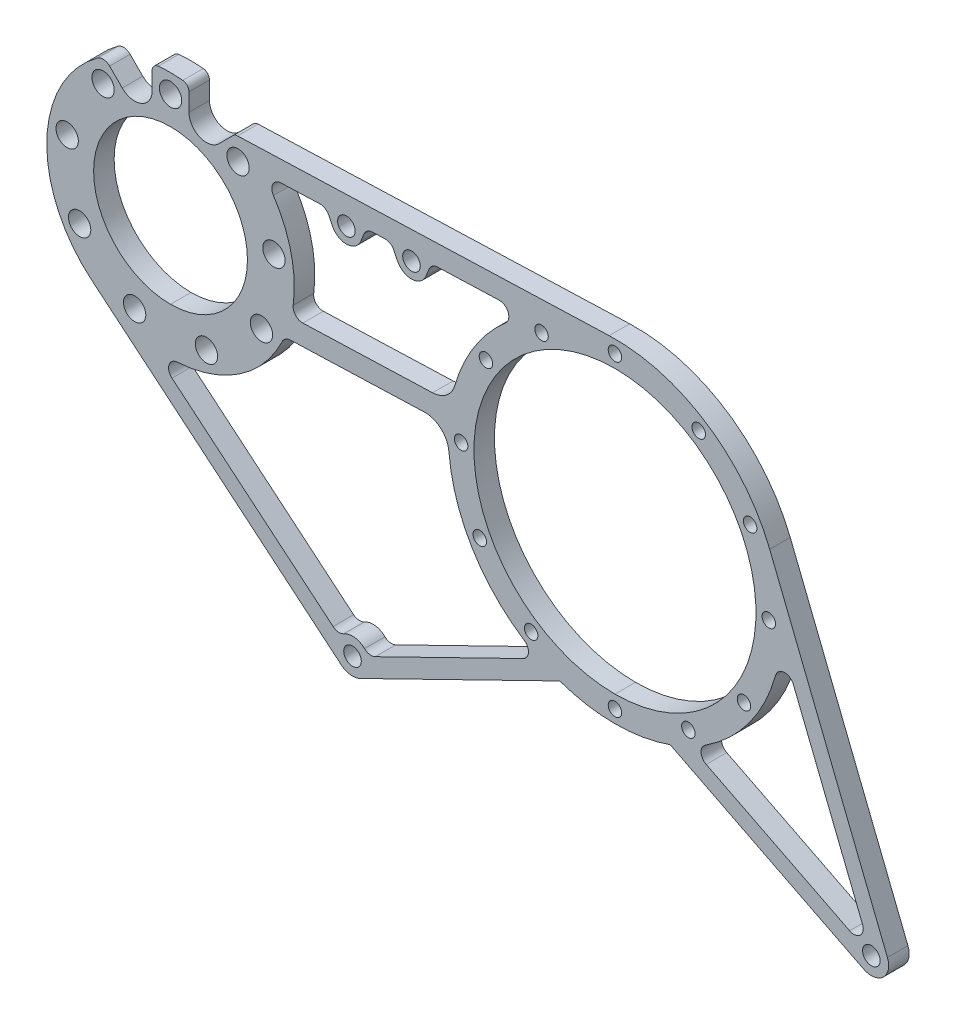
from build123d import *
from build123d.topology import SkipClean

# Parameters (mm, degrees)
SKETCH2_R               = 28.575
SKETCH2_R_2             = 3.2639
SKETCH2_R_3             = 52.3875
BOSS_EXTRUDE1_DEPTH     = 7.62
CUT_EXTRUDE1_DEPTH      = 369.573342704
CUT_EXTRUDE1_DEPTH_BACK = 369.573342704
SKETCH3_R               = 4.15
SKETCH3_R_2             = 2.5
CUT_EXTRUDE2_DEPTH      = 369.573342704
CUT_EXTRUDE2_DEPTH_BACK = 369.573342704
BOSS_EXTRUDE2_DEPTH     = 7.62
CUT_EXTRUDE3_DEPTH      = 369.573342704
CUT_EXTRUDE3_DEPTH_BACK = 369.573342704
SKETCH12_R              = 3.2639


with BuildPart() as part:
    # Sketch2 → Boss-Extrude1 (new body)
    with BuildSketch(Plane.XY):
        with BuildLine():
            Line((-308.866129262, 91.710399516), (-215.926365234, 14.107506231))
            ThreePointArc((-215.926365234, 14.107506231), (-212.572921228, 12.657721799), (-208.970475069, 13.265869211))
            Line((-208.970475069, 13.265869211), (-134.814952137, 49.535152614))
            ThreePointArc((-134.814952137, 49.535152614), (-114.3, 46.0375), (-93.785047863, 49.535152614))
            Line((-93.785047863, 49.535152614), (-21.949808906, 13.301039962))
            ThreePointArc((-21.949808906, 13.301039962), (-14.699565425, 14.303090245), (-13.070560605, 21.438668609))
            Line((-13.070560605, 21.438668609), (-56.805390428, 130.917967399))
            ThreePointArc((-56.805390428, 130.917967399), (-80.468257666, 159.801430712), (-116.436314755, 169.825631839))
            Line((-116.436314755, 169.825631839), (-254.491729173, 165.059137987))
            ThreePointArc((-254.491729173, 165.059137987), (-255.416448823, 164.850182772), (-256.200136715, 164.316701751))
            Line((-256.200136715, 164.316701751), (-261.465020333, 159.051818133))
            ThreePointArc((-261.465020333, 159.051818133), (-268.548656721, 157.642795249), (-272.56121441, 163.648012211))
            Line((-272.56121441, 163.648012211), (-272.56121441, 170.220745001))
            ThreePointArc((-272.56121441, 170.220745001), (-273.218379704, 171.925600851), (-274.84982344, 172.748273949))
            ThreePointArc((-274.84982344, 172.748273949), (-279.4, 172.974), (-283.95017656, 172.748273949))
            ThreePointArc((-283.95017656, 172.748273949), (-285.581620296, 171.925600851), (-286.23878559, 170.220745001))
            Line((-286.23878559, 170.220745001), (-286.23878559, 163.648012211))
            ThreePointArc((-286.23878559, 163.648012211), (-290.251343279, 157.642795249), (-297.334979667, 159.051818133))
            Line((-297.334979667, 159.051818133), (-302.027964646, 163.744803112))
            ThreePointArc((-302.027964646, 163.744803112), (-304.229986022, 164.757469568), (-306.560860086, 164.09307692))
            ThreePointArc((-306.560860086, 164.09307692), (-325.350701602, 128.463454238), (-308.866129262, 91.710399516))
        make_face()
        with Locations((-279.4, 127)):
            Circle(SKETCH2_R, mode=Mode.SUBTRACT)
        with Locations(Location((-19.05, 19.05, 0), (0, 0, 180))):
            Circle(SKETCH2_R_2, mode=Mode.SUBTRACT)
        with Locations(Location((-211.799479175, 19.05, 0), (0, 0, 180))):
            Circle(SKETCH2_R_2, mode=Mode.SUBTRACT)
        with Locations((-114.3, 107.95)):
            Circle(SKETCH2_R_3, mode=Mode.SUBTRACT)
    extrude(amount=BOSS_EXTRUDE1_DEPTH)

    # Sketch3 → Cut-Extrude1 (cut, two sides: drawn at the far end of the back side and taken through both)
    with BuildSketch(Plane.XY.offset(7.62).offset(-CUT_EXTRUDE1_DEPTH_BACK)):
        with Locations((-279.4, 166)):
            Circle(SKETCH3_R)
        with Locations((-254.331283222, 156.875733282)):
            Circle(SKETCH3_R)
        with Locations((-240.992497633, 133.772278929)):
            Circle(SKETCH3_R)
        with Locations((-245.625009252, 107.5)):
            Circle(SKETCH3_R)
        with Locations((-266.06121441, 90.351987789)):
            Circle(SKETCH3_R)
        with Locations((-292.73878559, 90.351987789)):
            Circle(SKETCH3_R)
        with Locations((-313.174990748, 107.5)):
            Circle(SKETCH3_R)
        with Locations((-317.807502367, 133.772278929)):
            Circle(SKETCH3_R)
        with Locations((-304.468716778, 156.875733282)):
            Circle(SKETCH3_R)
        with Locations((-114.3, 165.1)):
            Circle(SKETCH3_R_2)
        with Locations((-57.15, 107.95)):
            Circle(SKETCH3_R_2)
        with Locations((-114.3, 50.8)):
            Circle(SKETCH3_R_2)
        with Locations((-171.45, 107.95)):
            Circle(SKETCH3_R_2)
        with Locations((-83.173879149, 155.880022958)):
            Circle(SKETCH3_R_2)
        with Locations((-64.075602011, 135.219623149)):
            Circle(SKETCH3_R_2)
        with Locations((-66.369977042, 76.823879149)):
            Circle(SKETCH3_R_2)
        with Locations((-87.030376851, 57.725602011)):
            Circle(SKETCH3_R_2)
        with Locations((-145.426120851, 60.019977042)):
            Circle(SKETCH3_R_2)
        with Locations((-164.524397989, 80.680376851)):
            Circle(SKETCH3_R_2)
        with Locations((-162.230022958, 139.076120851)):
            Circle(SKETCH3_R_2)
        with Locations((-141.569623149, 158.174397989)):
            Circle(SKETCH3_R_2)
    extrude(amount=CUT_EXTRUDE1_DEPTH + CUT_EXTRUDE1_DEPTH_BACK, mode=Mode.SUBTRACT)

    # Sketch4 → Cut-Extrude2 (cut, two sides: drawn at the far end of the back side and taken through both)
    with BuildSketch(Plane.XY.offset(7.62).offset(-CUT_EXTRUDE2_DEPTH_BACK)):
        with BuildLine():
            Line((-278.862624236, 74.930604639), (-219.018129111, 24.961616472))
            ThreePointArc((-219.018129111, 24.961616472), (-217.07692299, 24.16262829), (-215.028330647, 24.620812453))
            ThreePointArc((-215.028330647, 24.620812453), (-211.026037121, 25.442278201), (-207.335161059, 23.689967346))
            ThreePointArc((-207.335161059, 23.689967346), (-205.454963796, 22.756414152), (-203.379217054, 23.069365873))
            Line((-203.379217054, 23.069365873), (-148.393096208, 49.962941986))
            ThreePointArc((-148.393096208, 49.962941986), (-146.441473652, 52.888826728), (-148.025123052, 56.029158988))
            ThreePointArc((-148.025123052, 56.029158988), (-167.425190554, 76.155790074), (-175.994929719, 102.764124644))
            ThreePointArc((-175.994929719, 102.764124644), (-178.950352695, 108.666494642), (-185.160441746, 110.904192242))
            Line((-185.160441746, 110.904192242), (-234.876032851, 109.187714403))
            ThreePointArc((-234.876032851, 109.187714403), (-236.669637565, 108.61854745), (-237.907571885, 107.201336279))
            ThreePointArc((-237.907571885, 107.201336279), (-253.78883961, 88.82046177), (-276.820157686, 81.098441316))
            ThreePointArc((-276.820157686, 81.098441316), (-279.939618833, 78.709346862), (-278.862624236, 74.930604639))
        make_face()
        with BuildLine():
            Line((-48.019318761, 91.807143198), (-22.303873454, 27.434904147))
            ThreePointArc((-22.303873454, 27.434904147), (-23.187455951, 23.564521405), (-27.120033775, 23.021003007))
            Line((-27.120033775, 23.021003007), (-80.387932313, 49.889641079))
            ThreePointArc((-80.387932313, 49.889641079), (-82.302626367, 52.822384958), (-80.709884678, 55.941714036))
            ThreePointArc((-80.709884678, 55.941714036), (-64.405072396, 71.294115674), (-54.62867895, 91.442695545))
            ThreePointArc((-54.62867895, 91.442695545), (-51.454892751, 93.998716793), (-48.019318761, 91.807143198))
        make_face()
        with BuildLine():
            Line((-238.402359266, 157.990098388), (-157.34562354, 160.788658909))
            ThreePointArc((-157.34562354, 160.788658909), (-153.975579676, 158.578116117), (-154.932995767, 154.663138529))
            ThreePointArc((-154.932995767, 154.663138529), (-166.508163426, 141.228601653), (-173.800186524, 125.063896689))
            ThreePointArc((-173.800186524, 125.063896689), (-176.874809559, 120.512552862), (-182.037050163, 118.636570616))
            Line((-182.037050163, 118.636570616), (-230.24689137, 116.972080217))
            ThreePointArc((-230.24689137, 116.972080217), (-232.955010122, 118.116900866), (-233.829266544, 120.924069761))
            ThreePointArc((-233.829266544, 120.924069761), (-234.620613955, 137.412264953), (-241.184927886, 152.558109071))
            ThreePointArc((-241.184927886, 152.558109071), (-241.390248986, 156.091974283), (-238.402359266, 157.990098388))
        make_face()
    extrude(amount=CUT_EXTRUDE2_DEPTH + CUT_EXTRUDE2_DEPTH_BACK, mode=Mode.SUBTRACT)

    # Sketch11 → Boss-Extrude2 (add)
    with BuildSketch(Plane(origin=(0, 0, 0), x_dir=(-1, 0, 0), z_dir=(0, 0, -1))):
        with BuildLine():
            Line((207.527120949, 156.980199935), (208.688714257, 154.101435278))
            ThreePointArc((208.688714257, 154.101435278), (213.870721133, 150.472754139), (219.290640683, 153.735420862))
            Line((219.290640683, 153.735420862), (220.647990696, 156.527200807))
            ThreePointArc((220.647990696, 156.527200807), (221.987721601, 157.992282798), (223.909468964, 158.49051087))
            Line((223.909468964, 158.49051087), (221.735746538, 158.565579296))
            Line((221.735746538, 158.565579296), (216.188353984, 158.757094079))
            ThreePointArc((216.188353984, 158.757094079), (213.958358328, 153.011241823), (212.129932329, 158.897204543))
            Line((212.129932329, 158.897204543), (206.582539776, 159.088719327))
            Line((206.582539776, 159.088719327), (204.408842654, 159.163760977))
            ThreePointArc((204.408842654, 159.163760977), (206.291633306, 158.534177501), (207.527120949, 156.980199935))
        make_face()
        with BuildLine():
            ThreePointArc((199.725649115, 159.325448413), (197.803922582, 158.827213892), (196.464204543, 157.362145264))
            Line((196.464204543, 157.362145264), (195.106835972, 154.570345104))
            ThreePointArc((195.106835972, 154.570345104), (189.686908084, 151.307692234), (184.504910482, 154.936386616))
            Line((184.504910482, 154.936386616), (183.343323694, 157.815156094))
            ThreePointArc((183.343323694, 157.815156094), (182.107841163, 159.369135959), (180.225053803, 159.998724924))
            Line((180.225053803, 159.998724924), (182.398748746, 159.923676049))
            Line((182.398748746, 159.923676049), (187.94614081, 159.732147087))
            ThreePointArc((187.94614081, 159.732147087), (189.774551766, 153.846179694), (192.004562108, 159.59202625))
            Line((192.004562108, 159.59202625), (197.551954171, 159.400497289))
            Line((197.551954171, 159.400497289), (199.725649115, 159.325448413))
        make_face()
    extrude(amount=-BOSS_EXTRUDE2_DEPTH)

    # Sketch12 → Cut-Extrude3 (cut, two sides: drawn at the far end of the back side and taken through both)
    with SkipClean():  # the faces are left unmerged after this step: merging them gives an invalid solid
        with BuildSketch(Plane(origin=(0, 0, 0), x_dir=(-1, 0, 0), z_dir=(0, 0, -1)).offset(-CUT_EXTRUDE3_DEPTH_BACK)):
            with Locations((189.887173898, 157.10813608)):
                Circle(SKETCH12_R)
            with Locations((214.070972123, 156.273198497)):
                Circle(SKETCH12_R)
        extrude(amount=CUT_EXTRUDE3_DEPTH + CUT_EXTRUDE3_DEPTH_BACK, mode=Mode.SUBTRACT)


solid = part.part
